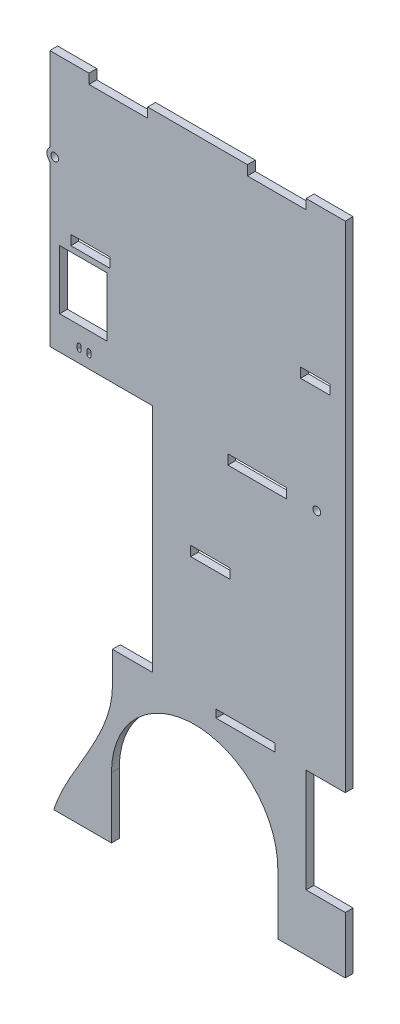
from build123d import *

# Parameters (mm, degrees)
SKETCH1_W           = 151
SKETCH1_H           = 253
BOSS_EXTRUDE1_DEPTH = 4
SKETCH2_W           = 52.50306414
SKETCH2_H           = 122.00289527
CUT_EXTRUDE1_DEPTH  = 5
CUT_EXTRUDE4_DEPTH  = 5
SKETCH8_R           = 2
CUT_EXTRUDE6_DEPTH  = 5
SKETCH10_R          = 4
SKETCH10_R_2        = 2
BOSS_EXTRUDE3_DEPTH = 4
SKETCH11_W          = 24.2
SKETCH11_H          = 30.2
CUT_EXTRUDE9_DEPTH  = 10
SKETCH16_W          = 118.99693586
SKETCH16_H          = 82
BOSS_EXTRUDE4_DEPTH = 4
BOSS_EXTRUDE5_DEPTH = 4
CUT_EXTRUDE13_DEPTH = 10
SKETCH27_W          = 20
SKETCH27_H          = 53
CUT_EXTRUDE14_DEPTH = 5
SKETCH29_W          = 20.5
SKETCH29_H          = 4
BOSS_EXTRUDE6_DEPTH = 4
SKETCH31_W          = 30
SKETCH31_H          = 5
SKETCH31_W_2        = 15.03868673
SKETCH31_W_3        = 20
SKETCH31_H_2        = 4
CUT_EXTRUDE16_DEPTH = 10
SKETCH32_R          = 2
CUT_EXTRUDE17_DEPTH = 10


with BuildPart() as part:
    # Sketch1 → Boss-Extrude1 (new body)
    with BuildSketch(Plane.XY):
        with Locations((0, -1)):
            Rectangle(SKETCH1_W, SKETCH1_H)
    extrude(amount=BOSS_EXTRUDE1_DEPTH)

    # Sketch2 → Cut-Extrude1 (cut)
    with BuildSketch(Plane.XY.offset(4)):
        with Locations((-49.24846793, -66.498552365)):
            Rectangle(SKETCH2_W, SKETCH2_H)
    extrude(amount=-CUT_EXTRUDE1_DEPTH, mode=Mode.SUBTRACT)

    # Sketch5 → Cut-Extrude4 (cut)
    with BuildSketch(Plane.XY.offset(4)):
        with BuildLine():
            Line((-61.5, 0.50289527), (-61.5, 2.50289527))
            ThreePointArc((-61.5, 2.50289527), (-60.5, 3.50289527), (-59.5, 2.50289527))
            Line((-59.5, 2.50289527), (-59.5, 0.50289527))
            ThreePointArc((-59.5, 0.50289527), (-60.5, -0.49710473), (-61.5, 0.50289527))
        make_face()
        with BuildLine():
            Line((-56.5, 0.50289527), (-56.5, 2.50289527))
            ThreePointArc((-56.5, 2.50289527), (-55.5, 3.50289527), (-54.5, 2.50289527))
            Line((-54.5, 2.50289527), (-54.5, 0.50289527))
            ThreePointArc((-54.5, 0.50289527), (-55.5, -0.49710473), (-56.5, 0.50289527))
        make_face()
    extrude(amount=-CUT_EXTRUDE4_DEPTH, mode=Mode.SUBTRACT)

    # Sketch8 → Cut-Extrude6 (cut)
    with BuildSketch(Plane.XY.offset(4)):
        with Locations((-73, 79.562158061)):
            Circle(SKETCH8_R)
    extrude(amount=-CUT_EXTRUDE6_DEPTH, mode=Mode.SUBTRACT)

    # Sketch10 → Boss-Extrude3 (add)
    with BuildSketch(Plane.XY.offset(4)):
        with Locations((-73, 79.562158061)):
            Circle(SKETCH10_R)
        with Locations((-73, 79.562158061)):
            Circle(SKETCH10_R_2, mode=Mode.SUBTRACT)
    extrude(amount=-BOSS_EXTRUDE3_DEPTH)

    # Sketch11 → Cut-Extrude9 (cut)
    with BuildSketch(Plane(origin=(0, 0, 0), x_dir=(-1, 0, 0), z_dir=(0, 0, -1))):
        with Locations((58.4, 26.6)):
            Rectangle(SKETCH11_W, SKETCH11_H)
    extrude(amount=-CUT_EXTRUDE9_DEPTH, mode=Mode.SUBTRACT)

    # Sketch16 → Boss-Extrude4 (add)
    with BuildSketch(Plane.XY.offset(4)):
        with Locations((16.00153207, -168.5)):
            Rectangle(SKETCH16_W, SKETCH16_H)
    extrude(amount=-BOSS_EXTRUDE4_DEPTH)

    # Sketch24 → Boss-Extrude5 (add)
    with BuildSketch(Plane.XY.offset(4)):
        with BuildLine():
            Line((-43.49693586, -209.5), (-43.49693586, -140.130236158))
            add(Edge.make_bspline(
                [(-73.5, -209.5), (-66.548744275, -187.160783495), (-43.937613379, -164.067684131), (-43.49693586, -140.130236158)],
                knots=[0, 0, 0, 0, 0.851213122, 0.851213122, 0.851213122, 0.851213122], degree=3))
            Line((-73.5, -209.5), (-43.49693586, -209.5))
        make_face()
    extrude(amount=-BOSS_EXTRUDE5_DEPTH)

    # Sketch26 → Cut-Extrude13 (cut)
    with BuildSketch(Plane.XY.offset(4)):
        with BuildLine():
            Line((-44, -178.3), (-44, -209.5))
            Line((-44, -209.5), (41, -209.5))
            Line((41, -209.5), (41, -178.3))
            ThreePointArc((41, -178.3), (-1.5, -135.8), (-44, -178.3))
        make_face()
    extrude(amount=-CUT_EXTRUDE13_DEPTH, mode=Mode.SUBTRACT)

    # Sketch27 → Cut-Extrude14 (cut)
    with BuildSketch(Plane.XY.offset(4)):
        with Locations((65.5, -154)):
            Rectangle(SKETCH27_W, SKETCH27_H)
    extrude(amount=-CUT_EXTRUDE14_DEPTH, mode=Mode.SUBTRACT)

    # Sketch29 → Boss-Extrude6 (add)
    with BuildSketch(Plane.XY.offset(4)):
        with Locations((-33.24693586, -125.5)):
            Rectangle(SKETCH29_W, SKETCH29_H)
    extrude(amount=-BOSS_EXTRUDE6_DEPTH)

    # Sketch31 → Cut-Extrude16 (cut)
    with BuildSketch(Plane.XY.offset(4)):
        with Locations((40.5, 123)):
            Rectangle(SKETCH31_W, SKETCH31_H)
        with Locations((-40.5, 123)):
            Rectangle(SKETCH31_W, SKETCH31_H)
        with Locations((60.155656635, 47)):
            Rectangle(SKETCH31_W_2, SKETCH31_H)
        with Locations((30.5, -10)):
            Rectangle(SKETCH31_W, SKETCH31_H)
        with Locations((6.5, -60)):
            Rectangle(SKETCH31_W_3, SKETCH31_H)
        with Locations((-54.75, 47)):
            Rectangle(SKETCH31_W_3, SKETCH31_H)
        with Locations((24.5, -125.5)):
            Rectangle(SKETCH31_W, SKETCH31_H_2)
    extrude(amount=-CUT_EXTRUDE16_DEPTH, mode=Mode.SUBTRACT)

    # Sketch32 → Cut-Extrude17 (cut)
    with BuildSketch(Plane.XY.offset(4)):
        with Locations((60.936739195, -10)):
            Circle(SKETCH32_R)
    extrude(amount=-CUT_EXTRUDE17_DEPTH, mode=Mode.SUBTRACT)


solid = part.part
